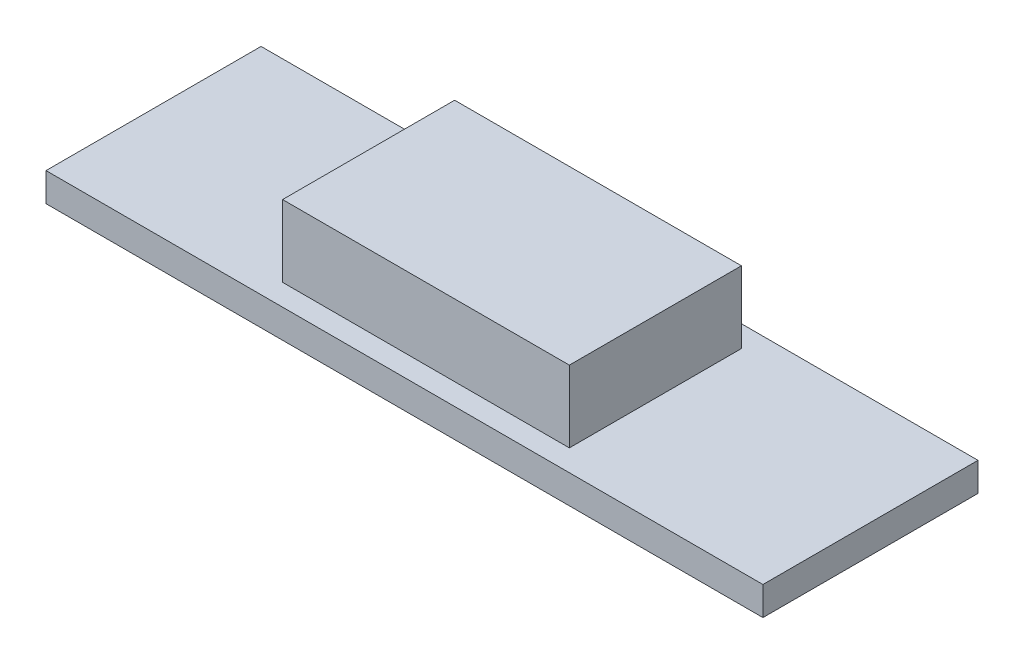
from build123d import *

# Parameters (mm, degrees)
SKETCH1_W           = 20
SKETCH1_H           = 12
BOSS_EXTRUDE1_DEPTH = 5
SKETCH2_W           = 50
SKETCH2_H           = 15
BOSS_EXTRUDE2_DEPTH = 2


with BuildPart() as part:
    # Sketch1 → Boss-Extrude1 (new body)
    with BuildSketch(Plane(origin=(0, 0, 0), x_dir=(1, 0, 0), z_dir=(0, 1, 0))):
        Rectangle(SKETCH1_W, SKETCH1_H)
    extrude(amount=BOSS_EXTRUDE1_DEPTH)

    # Sketch2 → Boss-Extrude2 (add)
    with BuildSketch(Plane.XZ):
        Rectangle(SKETCH2_W, SKETCH2_H)
    extrude(amount=BOSS_EXTRUDE2_DEPTH)


solid = part.part
